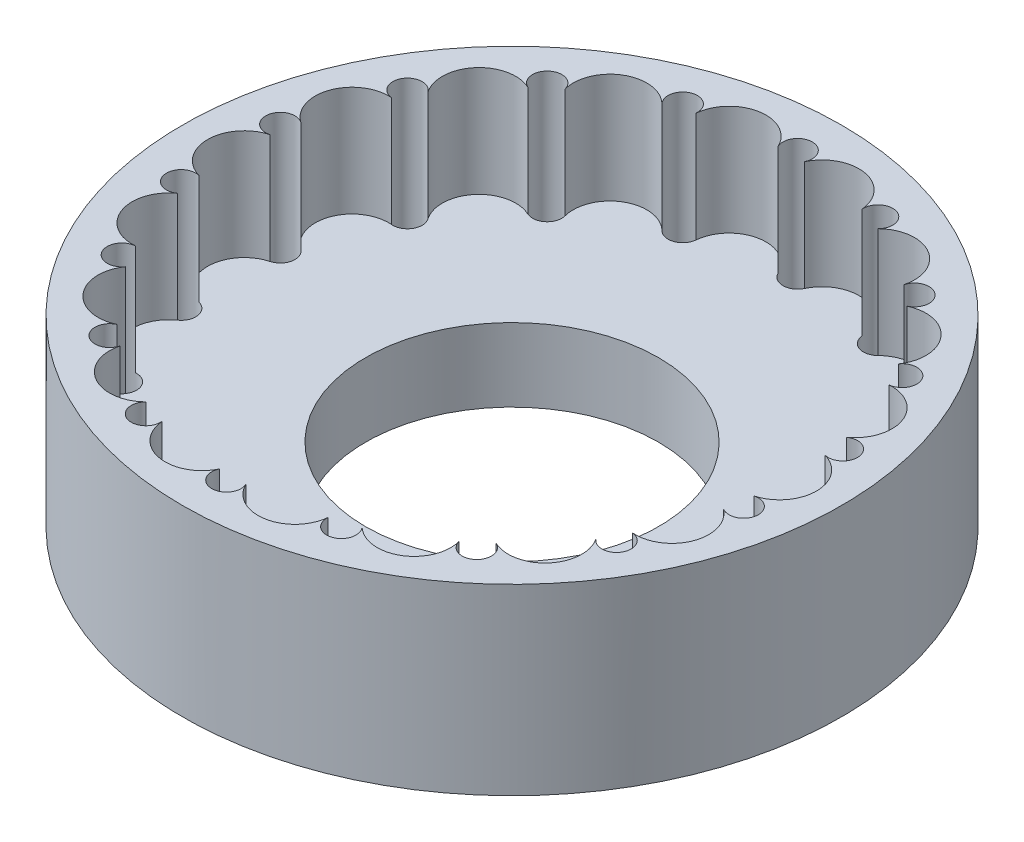
from build123d import *

# Parameters (mm, degrees)
SKETCH1_R           = 45
SKETCH1_R_2         = 2
SKETCH1_R_3         = 20
BOSS_EXTRUDE1_DEPTH = 5
BOSS_EXTRUDE2_START = 5
SKETCH2_R           = 45
SKETCH2_R_2         = 20
BOSS_EXTRUDE2_DEPTH = 5
SKETCH3_R           = 45
BOSS_EXTRUDE3_DEPTH = 20
CUT_EXTRUDE1_START  = -20
SKETCH4_R           = 2
CUT_EXTRUDE1_DEPTH  = 20


with BuildPart() as part:
    # Sketch1 → Boss-Extrude1 (new body)
    with BuildSketch(Plane(origin=(0, 0, 0), x_dir=(1, 0, 0), z_dir=(0, 1, 0))):
        with Locations(Location((0, 0, 0), (0, 0, 270))):
            Circle(SKETCH1_R)
        with Locations(Location((0, 39, 0), (0, 0, 270))):
            Circle(SKETCH1_R_2, mode=Mode.SUBTRACT)
        with Locations(Location((13.33878559, 36.648012211, 0), (0, 0, 270))):
            Circle(SKETCH1_R_2, mode=Mode.SUBTRACT)
        with Locations(Location((25.068716778, 29.875733282, 0), (0, 0, 270))):
            Circle(SKETCH1_R_2, mode=Mode.SUBTRACT)
        with Locations(Location((33.774990748, 19.5, 0), (0, 0, 270))):
            Circle(SKETCH1_R_2, mode=Mode.SUBTRACT)
        with Locations(Location((38.407502367, 6.772278929, 0), (0, 0, 270))):
            Circle(SKETCH1_R_2, mode=Mode.SUBTRACT)
        with Locations(Location((38.407502367, -6.772278929, 0), (0, 0, 270))):
            Circle(SKETCH1_R_2, mode=Mode.SUBTRACT)
        with Locations(Location((33.774990748, -19.5, 0), (0, 0, 270))):
            Circle(SKETCH1_R_2, mode=Mode.SUBTRACT)
        with Locations(Location((25.068716778, -29.875733282, 0), (0, 0, 270))):
            Circle(SKETCH1_R_2, mode=Mode.SUBTRACT)
        with Locations(Location((13.33878559, -36.648012211, 0), (0, 0, 270))):
            Circle(SKETCH1_R_2, mode=Mode.SUBTRACT)
        with Locations(Location((0, -39, 0), (0, 0, 270))):
            Circle(SKETCH1_R_2, mode=Mode.SUBTRACT)
        with Locations(Location((-13.33878559, -36.648012211, 0), (0, 0, 270))):
            Circle(SKETCH1_R_2, mode=Mode.SUBTRACT)
        with Locations(Location((-25.068716778, -29.875733282, 0), (0, 0, 270))):
            Circle(SKETCH1_R_2, mode=Mode.SUBTRACT)
        with Locations(Location((-33.774990748, -19.5, 0), (0, 0, 270))):
            Circle(SKETCH1_R_2, mode=Mode.SUBTRACT)
        with Locations(Location((-38.407502367, -6.772278929, 0), (0, 0, 270))):
            Circle(SKETCH1_R_2, mode=Mode.SUBTRACT)
        with Locations(Location((-38.407502367, 6.772278929, 0), (0, 0, 270))):
            Circle(SKETCH1_R_2, mode=Mode.SUBTRACT)
        with Locations(Location((-33.774990748, 19.5, 0), (0, 0, 270))):
            Circle(SKETCH1_R_2, mode=Mode.SUBTRACT)
        with Locations(Location((-25.068716778, 29.875733282, 0), (0, 0, 270))):
            Circle(SKETCH1_R_2, mode=Mode.SUBTRACT)
        with Locations(Location((-13.33878559, 36.648012211, 0), (0, 0, 270))):
            Circle(SKETCH1_R_2, mode=Mode.SUBTRACT)
        with Locations(Location((0, 0, 0), (0, 0, 270))):
            Circle(SKETCH1_R_3, mode=Mode.SUBTRACT)
    extrude(amount=BOSS_EXTRUDE1_DEPTH)

    # Sketch2 → Boss-Extrude2 (add)
    with BuildSketch(Plane.XZ.offset(BOSS_EXTRUDE2_START)):
        with Locations(Location((0, 0, 0), (0, 0, 270))):
            Circle(SKETCH2_R)
        with Locations(Location((0, 0, 0), (0, 0, 270))):
            Circle(SKETCH2_R_2, mode=Mode.SUBTRACT)
    extrude(amount=-BOSS_EXTRUDE2_DEPTH)

    # Sketch3 → Boss-Extrude3 (add)
    with BuildSketch(Plane(origin=(0, 0, 0), x_dir=(1, 0, 0), z_dir=(0, 1, 0))):
        with Locations(Location((0, 0, 0), (0, 0, 90))):
            Circle(SKETCH3_R)
        with BuildLine():
            ThreePointArc((-33.939016056, 17.506737424), (-32.04293994, 18.5), (-32.130787374, 20.638681372))
            ThreePointArc((-32.130787374, 20.638681372), (-31.849324915, 26.724756789), (-25.904586102, 28.058779107))
            ThreePointArc((-25.904586102, 28.058779107), (-23.783141558, 28.343644395), (-23.134219035, 30.383393091))
            ThreePointArc((-23.134219035, 30.383393091), (-20.788170452, 36.006167419), (-14.745680753, 35.226517926))
            ThreePointArc((-14.745680753, 35.226517926), (-12.654745303, 34.768626969), (-11.347322455, 36.463419192))
            ThreePointArc((-11.347322455, 36.463419192), (-7.219655832, 40.944702864), (-1.808228682, 38.145418796))
            ThreePointArc((-1.808228682, 38.145418796), (0, 37), (1.808228682, 38.145418796))
            ThreePointArc((1.808228682, 38.145418796), (7.219655832, 40.944702864), (11.347322455, 36.463419192))
            ThreePointArc((11.347322455, 36.463419192), (12.654745303, 34.768626969), (14.745680753, 35.226517926))
            ThreePointArc((14.745680753, 35.226517926), (20.788170452, 36.006167419), (23.134219035, 30.383393091))
            ThreePointArc((23.134219035, 30.383393091), (23.783141558, 28.343644395), (25.904586102, 28.058779107))
            ThreePointArc((25.904586102, 28.058779107), (31.849324915, 26.724756789), (32.130787374, 20.638681372))
            ThreePointArc((32.130787374, 20.638681372), (32.04293994, 18.5), (33.939016056, 17.506737424))
            ThreePointArc((33.939016056, 17.506737424), (39.068980747, 14.219946075), (37.251908557, 8.404640085))
            ThreePointArc((37.251908557, 8.404640085), (36.437886861, 6.424982574), (37.879899788, 4.843124835))
            ThreePointArc((37.879899788, 4.843124835), (41.576340904, 0), (37.879899788, -4.843124835))
            ThreePointArc((37.879899788, -4.843124835), (36.437886861, -6.424982574), (37.251908557, -8.404640085))
            ThreePointArc((37.251908557, -8.404640085), (39.068980747, -14.219946075), (33.939016056, -17.506737424))
            ThreePointArc((33.939016056, -17.506737424), (32.04293994, -18.5), (32.130787374, -20.638681372))
            ThreePointArc((32.130787374, -20.638681372), (31.849324915, -26.724756789), (25.904586102, -28.058779107))
            ThreePointArc((25.904586102, -28.058779107), (23.783141558, -28.343644395), (23.134219035, -30.383393091))
            ThreePointArc((23.134219035, -30.383393091), (20.788170452, -36.006167419), (14.745680753, -35.226517926))
            ThreePointArc((14.745680753, -35.226517926), (12.654745303, -34.768626969), (11.347322455, -36.463419192))
            ThreePointArc((11.347322455, -36.463419192), (7.219655832, -40.944702864), (1.808228682, -38.145418796))
            ThreePointArc((1.808228682, -38.145418796), (0, -37), (-1.808228682, -38.145418796))
            ThreePointArc((-1.808228682, -38.145418796), (-7.219655832, -40.944702864), (-11.347322455, -36.463419192))
            ThreePointArc((-11.347322455, -36.463419192), (-12.654745303, -34.768626969), (-14.745680753, -35.226517926))
            ThreePointArc((-14.745680753, -35.226517926), (-20.788170452, -36.006167419), (-23.134219035, -30.383393091))
            ThreePointArc((-23.134219035, -30.383393091), (-23.783141558, -28.343644395), (-25.904586102, -28.058779107))
            ThreePointArc((-25.904586102, -28.058779107), (-31.849324915, -26.724756789), (-32.130787374, -20.638681372))
            ThreePointArc((-32.130787374, -20.638681372), (-32.04293994, -18.5), (-33.939016056, -17.506737424))
            ThreePointArc((-33.939016056, -17.506737424), (-39.068980747, -14.219946075), (-37.251908557, -8.404640085))
            ThreePointArc((-37.251908557, -8.404640085), (-36.437886861, -6.424982574), (-37.879899788, -4.843124835))
            ThreePointArc((-37.879899788, -4.843124835), (-41.576340904, 0), (-37.879899788, 4.843124835))
            ThreePointArc((-37.879899788, 4.843124835), (-36.437886861, 6.424982574), (-37.251908557, 8.404640085))
            ThreePointArc((-37.251908557, 8.404640085), (-39.068980747, 14.219946075), (-33.939016056, 17.506737424))
        make_face(mode=Mode.SUBTRACT)
    extrude(amount=BOSS_EXTRUDE3_DEPTH)

    # Sketch4 → Cut-Extrude1 (cut)
    with BuildSketch(Plane(origin=(0, 20, 0), x_dir=(1, 0, 0), z_dir=(0, 1, 0)).offset(CUT_EXTRUDE1_START)):
        with Locations(Location((0, 39, 0), (0, 0, 270))):
            Circle(SKETCH4_R)
        with Locations(Location((13.33878559, 36.648012211, 0), (0, 0, 270))):
            Circle(SKETCH4_R)
        with Locations(Location((25.068716778, 29.875733282, 0), (0, 0, 270))):
            Circle(SKETCH4_R)
        with Locations(Location((33.774990748, 19.5, 0), (0, 0, 270))):
            Circle(SKETCH4_R)
        with Locations(Location((38.407502367, 6.772278929, 0), (0, 0, 270))):
            Circle(SKETCH4_R)
        with Locations(Location((38.407502367, -6.772278929, 0), (0, 0, 270))):
            Circle(SKETCH4_R)
        with Locations(Location((33.774990748, -19.5, 0), (0, 0, 270))):
            Circle(SKETCH4_R)
        with Locations(Location((25.068716778, -29.875733282, 0), (0, 0, 270))):
            Circle(SKETCH4_R)
        with Locations(Location((13.33878559, -36.648012211, 0), (0, 0, 270))):
            Circle(SKETCH4_R)
        with Locations(Location((0, -39, 0), (0, 0, 270))):
            Circle(SKETCH4_R)
        with Locations(Location((-13.33878559, -36.648012211, 0), (0, 0, 270))):
            Circle(SKETCH4_R)
        with Locations(Location((-25.068716778, -29.875733282, 0), (0, 0, 270))):
            Circle(SKETCH4_R)
        with Locations(Location((-33.774990748, -19.5, 0), (0, 0, 270))):
            Circle(SKETCH4_R)
        with Locations(Location((-38.407502367, -6.772278929, 0), (0, 0, 270))):
            Circle(SKETCH4_R)
        with Locations(Location((-38.407502367, 6.772278929, 0), (0, 0, 270))):
            Circle(SKETCH4_R)
        with Locations(Location((-33.774990748, 19.5, 0), (0, 0, 270))):
            Circle(SKETCH4_R)
        with Locations(Location((-25.068716778, 29.875733282, 0), (0, 0, 270))):
            Circle(SKETCH4_R)
        with Locations(Location((-13.33878559, 36.648012211, 0), (0, 0, 270))):
            Circle(SKETCH4_R)
    extrude(amount=CUT_EXTRUDE1_DEPTH, mode=Mode.SUBTRACT)


solid = part.part
